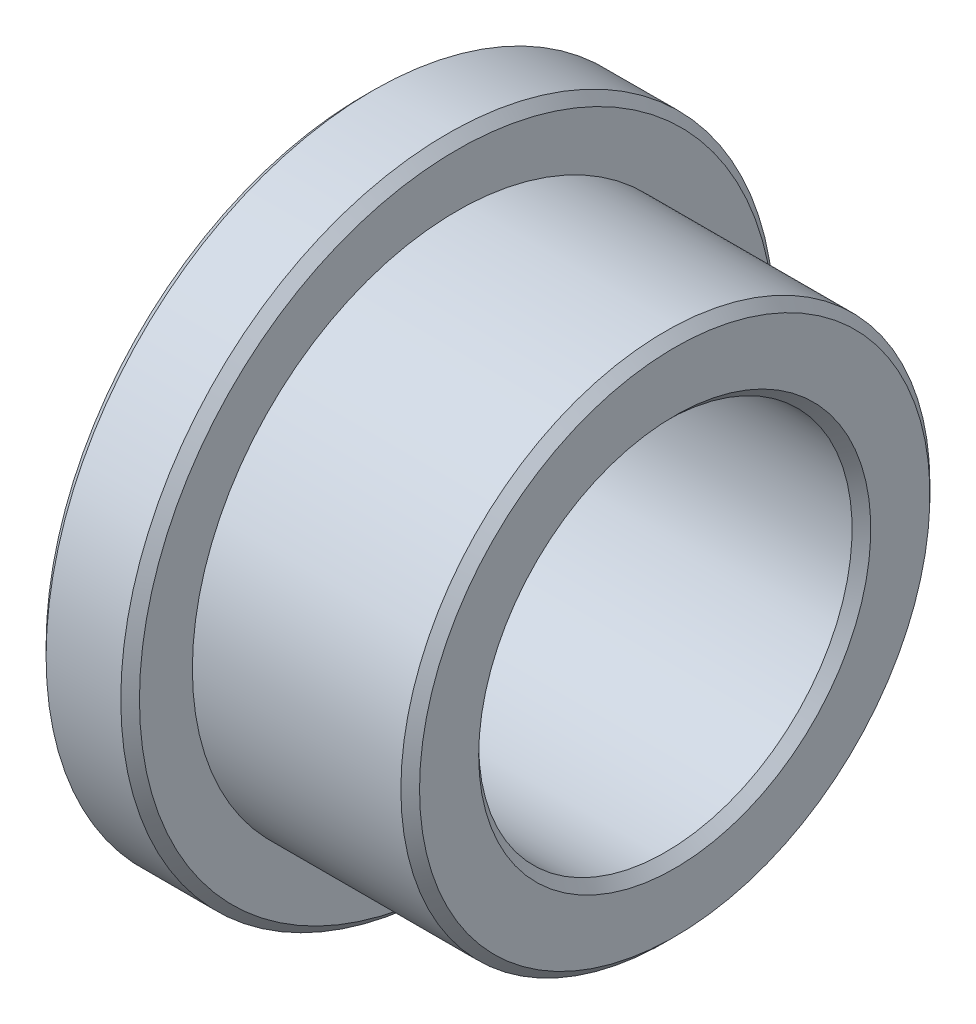
from build123d import *

# Parameters (mm, degrees)
CHAMFER1_SIZE = 0.3


with BuildPart() as part:
    # Sketch1 → Revolve1 (revolve)
    with BuildSketch(Plane.XY, mode=Mode.PRIVATE) as revolve1_sk:
        Polygon((0, 6), (0, 10.5), (3, 10.5), (3, 8.5), (10, 8.5), (10, 6), align=None)
    revolve(revolve1_sk.sketch.rotate(Axis((0, 0, 0), (1, 0, 0)), 90), axis=Axis((0, 0, 0), (1, 0, 0)))

    # Chamfer1
    chamfer1_edges = [part.edges().sort_by_distance(p)[0] for p in [
        (10, 0, -6),
        (10, 0, -8.5),
        (3, 0, -10.5),
        (0, 0, -10.5),
        (0, 0, -6),
    ]]
    chamfer(chamfer1_edges, length=CHAMFER1_SIZE)


solid = part.part
